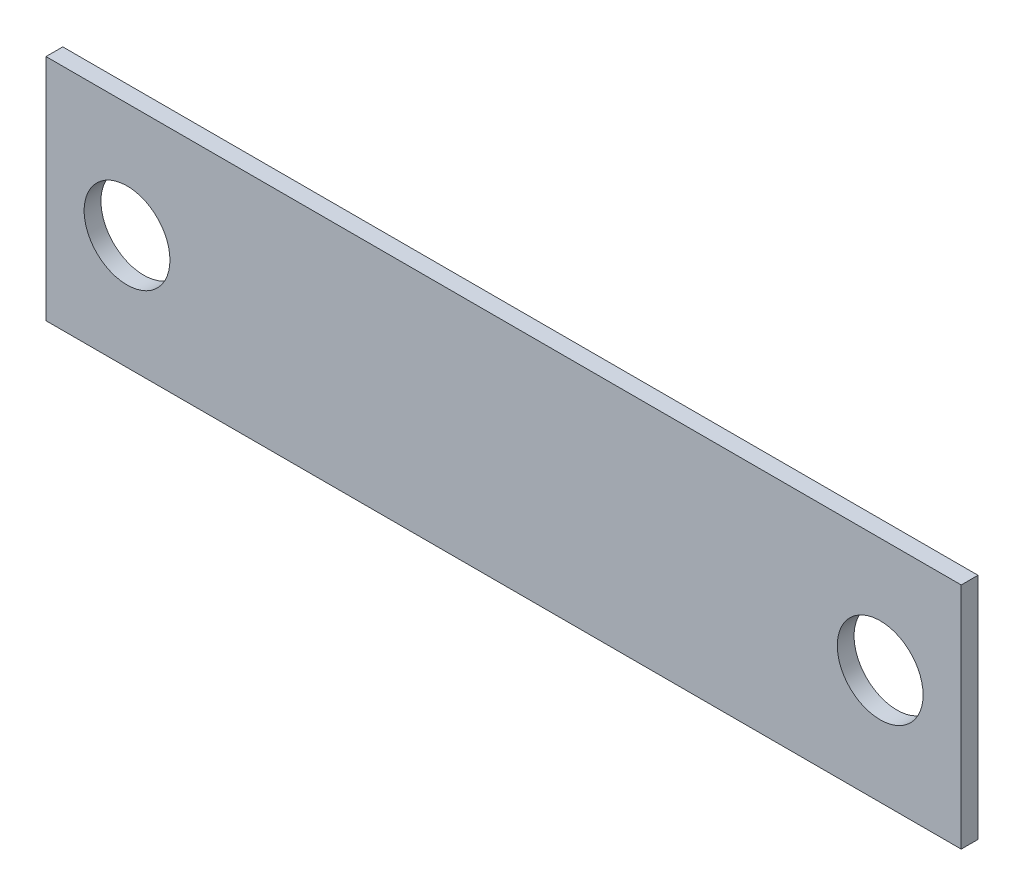
from build123d import *

# Parameters (mm, degrees)
SKETCH1_W           = 304.8
SKETCH1_H           = 76.2
BOSS_EXTRUDE1_DEPTH = 5.588
SKETCH2_R           = 14.2875
CUT_EXTRUDE1_DEPTH  = 158.189680781


with BuildPart() as part:
    # Sketch1 → Boss-Extrude1 (new body)
    with BuildSketch(Plane.XY):
        Rectangle(SKETCH1_W, SKETCH1_H)
    extrude(amount=BOSS_EXTRUDE1_DEPTH)

    # Sketch2 → Cut-Extrude1 (cut, through all)
    with BuildSketch(Plane.XY.offset(5.588)):
        with Locations((-125.4125, 0)):
            Circle(SKETCH2_R)
        with Locations((125.4125, 0)):
            Circle(SKETCH2_R)
    extrude(amount=-CUT_EXTRUDE1_DEPTH, mode=Mode.SUBTRACT)


solid = part.part
